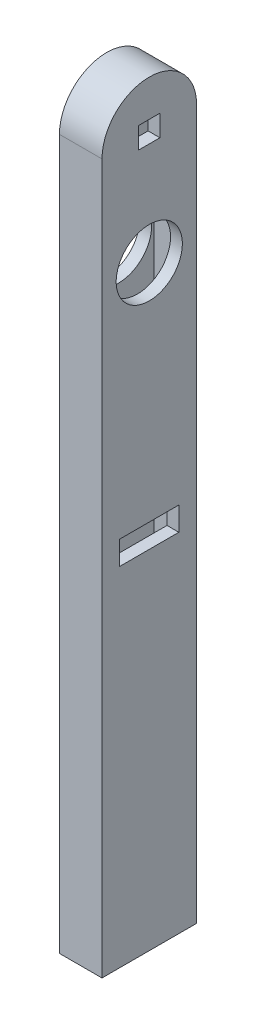
from build123d import *

# Parameters (mm, degrees)
BOSS_EXTRUDE1_START = -9
SKETCH2_R           = 14
SKETCH2_W           = 9
SKETCH2_H           = 9
BOSS_EXTRUDE1_DEPTH = 5
BOSS_EXTRUDE2_START = -4
BOSS_EXTRUDE2_DEPTH = 4
CUT_EXTRUDE1_START  = 9
SKETCH4_W           = 25
SKETCH4_H           = 10
CUT_EXTRUDE1_DEPTH  = 13


with BuildPart() as part:
    # Sketch2 → Boss-Extrude1 (new body)
    with BuildSketch(Plane(origin=(0, 0, 0), x_dir=(0, 0, -1), z_dir=(1, 0, 0)).offset(BOSS_EXTRUDE1_START)):
        with BuildLine():
            Line((-20, 48), (-20, -252))
            Line((-20, -252), (20, -252))
            Line((20, -252), (20, 48))
            ThreePointArc((20, 48), (0, 68), (-20, 48))
        make_face()
        Circle(SKETCH2_R, mode=Mode.SUBTRACT)
        with Locations((0, 48)):
            Rectangle(SKETCH2_W, SKETCH2_H, mode=Mode.SUBTRACT)
    extrude(amount=BOSS_EXTRUDE1_DEPTH)

    # Sketch2<6> → Boss-Extrude2 (add)
    with BuildSketch(Plane(origin=(0, 0, 0), x_dir=(0, 0, -1), z_dir=(1, 0, 0)).offset(BOSS_EXTRUDE2_START)):
        with BuildLine():
            Line((-20, 48), (-20, -252))
            Line((-20, -252), (20, -252))
            Line((20, -252), (20, 48))
            ThreePointArc((20, 48), (0, 68), (-20, 48))
        make_face()
        with BuildLine():
            Line((15, 48), (15, -247))
            Line((15, -247), (-15, -247))
            Line((-15, -247), (-15, 48))
            ThreePointArc((-15, 48), (0, 63), (15, 48))
        make_face(mode=Mode.SUBTRACT)
    extrude(amount=BOSS_EXTRUDE2_DEPTH)

    # Mirror1: part across plane


with BuildPart() as part_1:
    add(part.part)
    add(part.part.mirror(Plane(origin=(0, 0, 0), x_dir=(0, 0, 1), z_dir=(1, 0, 0))))

    # Sketch4 → Cut-Extrude1 (cut)
    with BuildSketch(Plane(origin=(0, 0, 0), x_dir=(0, 0, -1), z_dir=(1, 0, 0)).offset(CUT_EXTRUDE1_START)):
        with Locations((0, -100)):
            Rectangle(SKETCH4_W, SKETCH4_H)
    extrude(amount=-CUT_EXTRUDE1_DEPTH, mode=Mode.SUBTRACT)


solid = part_1.part
